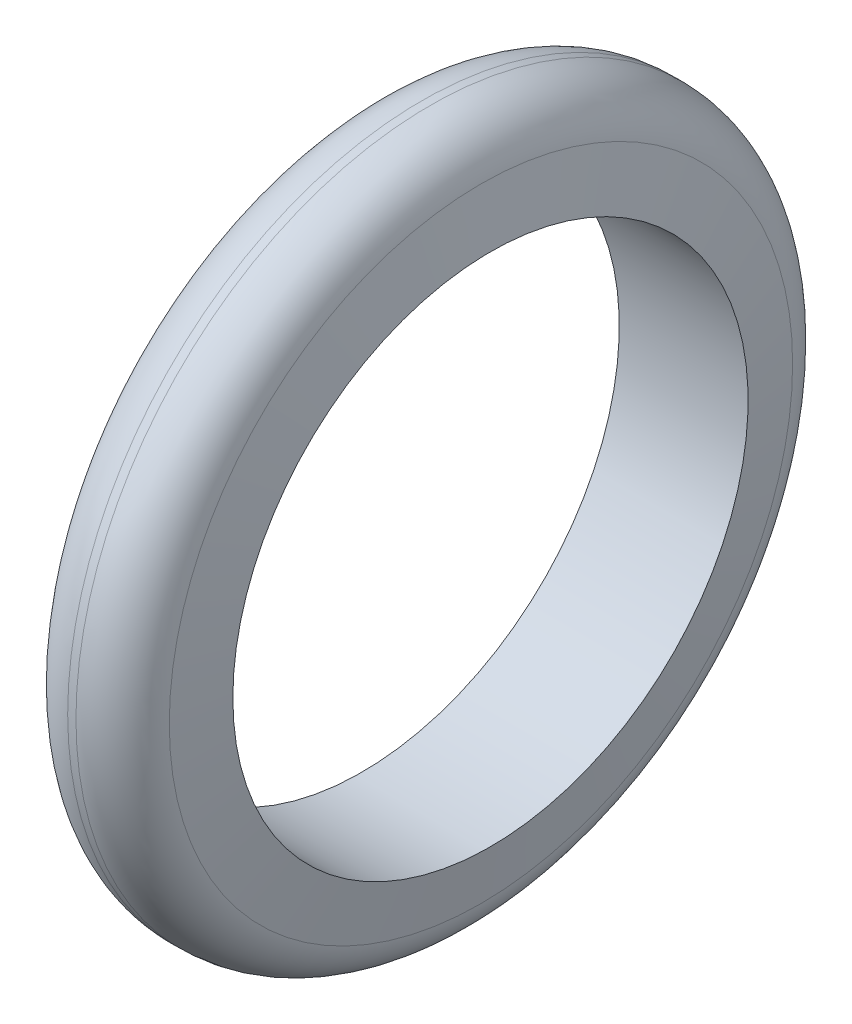
from build123d import *

# Parameters (mm, degrees)
FILLET1_R = 8


with BuildPart() as part:
    # Sketch1 → Revolve1 (revolve)
    with BuildSketch(Plane.XY, mode=Mode.PRIVATE) as revolve1_sk:
        Polygon((-7.355095289, 55), (7.355095289, 55), (10, 40), (-10, 40), align=None)
    revolve(revolve1_sk.sketch.rotate(Axis((0, 0, 0), (1, 0, 0)), 90), axis=Axis((0, 0, 0), (1, 0, 0)))

    # Fillet1
    fillet1_edges = [part.edges().sort_by_distance(p)[0] for p in [
        (-7.355095289, 0, -55),
        (7.355095289, 0, -55),
    ]]
    fillet(fillet1_edges, radius=FILLET1_R)


solid = part.part
